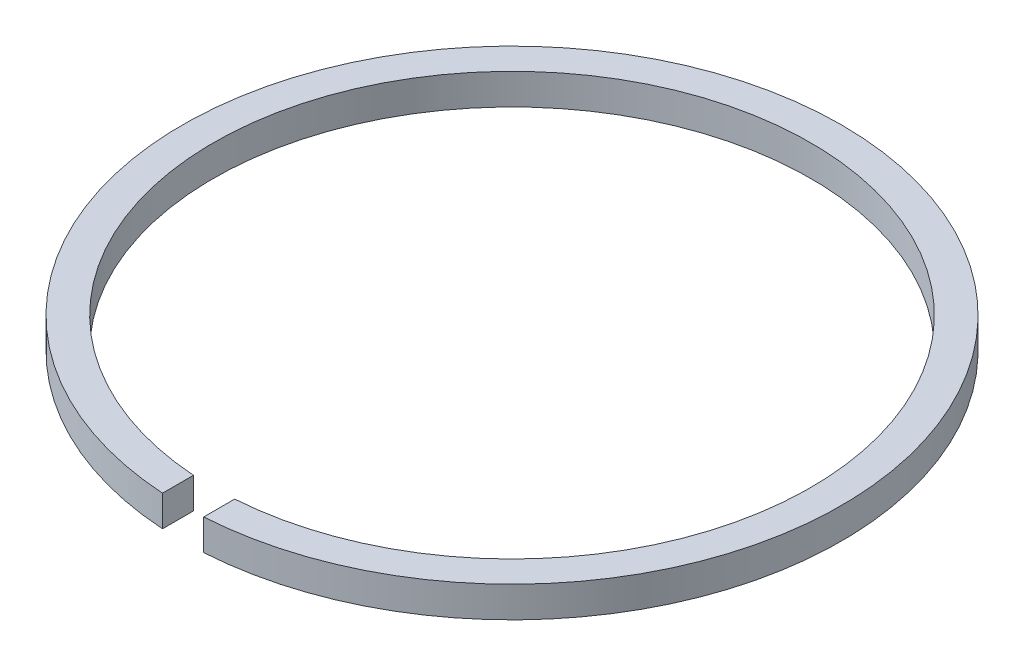
from build123d import *

# Parameters (mm, degrees)
SKETCH1_R           = 16
SKETCH1_R_2         = 14.5
BOSS_EXTRUDE1_DEPTH = 0.75
SKETCH3_W           = 2
SKETCH3_H           = 4
CUT_EXTRUDE2_DEPTH  = 23.677080941


with BuildPart() as part:
    # Sketch1 → Boss-Extrude1 (new, symmetric)
    with BuildSketch(Plane(origin=(0, 0, 0), x_dir=(1, 0, 0), z_dir=(0, 1, 0))):
        with Locations(Location((0, 0, 0), (0, 0, 270))):
            Circle(SKETCH1_R)
        with Locations(Location((0, 0, 0), (0, 0, 270))):
            Circle(SKETCH1_R_2, mode=Mode.SUBTRACT)
    extrude(amount=BOSS_EXTRUDE1_DEPTH, both=True)

    # Sketch3 → Cut-Extrude2 (cut, through all)
    with BuildSketch(Plane(origin=(0, 0.75, 0), x_dir=(1, 0, 0), z_dir=(0, 1, 0))):
        with Locations((0, -15.502423941)):
            Rectangle(SKETCH3_W, SKETCH3_H)
    extrude(amount=-CUT_EXTRUDE2_DEPTH, mode=Mode.SUBTRACT)


solid = part.part
